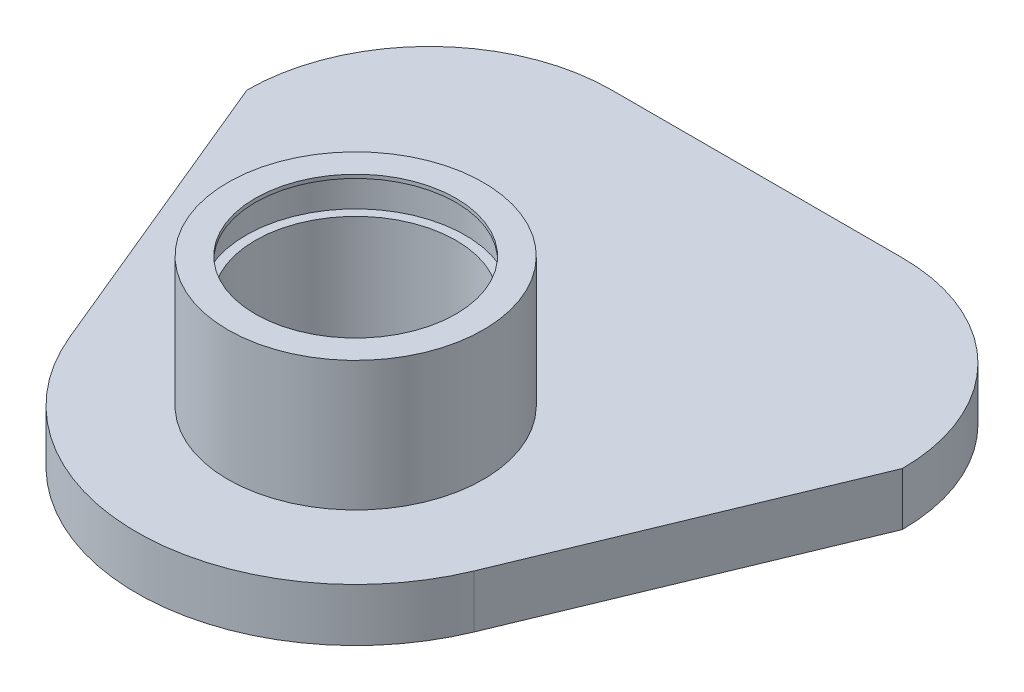
from build123d import *

# Parameters (mm, degrees)
BOSS_EXTRUDE1_DEPTH = 2.9
SKETCH1_3_R         = 7
BOSS_EXTRUDE2_DEPTH = 10
SKETCH7_R           = 5.5
CUT_EXTRUDE10_DEPTH = 8
SKETCH8_R           = 6
SKETCH8_R_2         = 5.5
CUT_EXTRUDE11_DEPTH = 1.8


with BuildPart() as part:
    # Sketch1 → Boss-Extrude1 (new body)
    with BuildSketch(Plane(origin=(0, 0, 0), x_dir=(1, 0, 0), z_dir=(0, 1, 0))):
        with BuildLine():
            Line((-17.959269152, 12), (-11.086554257, -4.59220151))
            ThreePointArc((-11.086554257, -4.59220151), (1.96e-07, -12), (11.086554407, -4.592201147))
            Line((11.086554407, -4.592201147), (17.959269152, 12))
            Line((17.959269152, 12), (17.959269152, 12.01))
            ThreePointArc((17.959269152, 12.01), (15.033265896, 19.073996744), (7.969269152, 22))
            Line((7.969269152, 22), (-7.969269152, 22))
            ThreePointArc((-7.969269152, 22), (-15.033265896, 19.073996744), (-17.959269152, 12.01))
            Line((-17.959269152, 12.01), (-17.959269152, 12))
        make_face()
    extrude(amount=BOSS_EXTRUDE1_DEPTH)

    # Sketch1<3> → Boss-Extrude2 (add)
    with BuildSketch(Plane(origin=(0, 0, 0), x_dir=(1, 0, 0), z_dir=(0, 1, 0))):
        Circle(SKETCH1_3_R)
    extrude(amount=BOSS_EXTRUDE2_DEPTH)

    # Sketch7 → Cut-Extrude10 (cut)
    with BuildSketch(Plane(origin=(0, 10, 0), x_dir=(1, 0, 0), z_dir=(0, 1, 0))):
        Circle(SKETCH7_R)
    extrude(amount=-CUT_EXTRUDE10_DEPTH, mode=Mode.SUBTRACT)

    # Sketch8 → Cut-Extrude11 (cut)
    with BuildSketch(Plane(origin=(0, 9.8, 0), x_dir=(1, 0, 0), z_dir=(0, 1, 0))):
        Circle(SKETCH8_R)
        Circle(SKETCH8_R_2, mode=Mode.SUBTRACT)
    extrude(amount=-CUT_EXTRUDE11_DEPTH, mode=Mode.SUBTRACT)


solid = part.part
